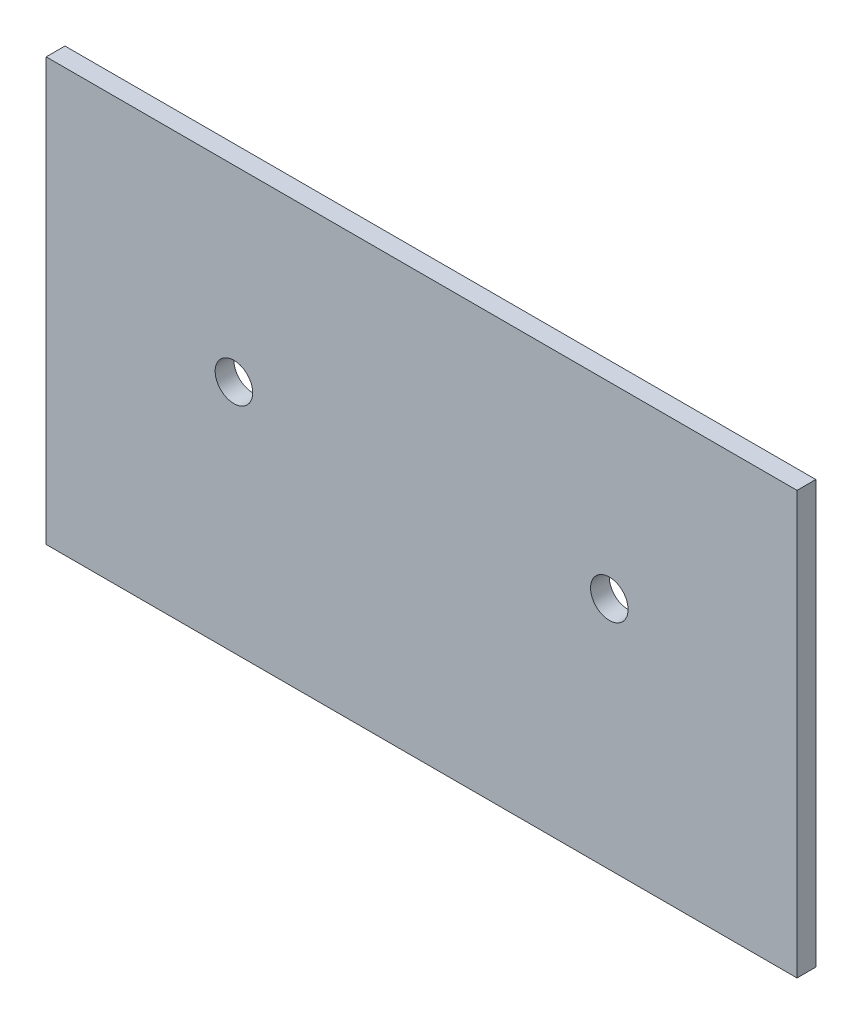
from build123d import *

# Parameters (mm, degrees)
SKETCH1_W           = 80
SKETCH1_H           = 45
BOSS_EXTRUDE1_DEPTH = 2
SKETCH2_R           = 2
CUT_EXTRUDE1_DEPTH  = 46.937457483


with BuildPart() as part:
    # Sketch1 → Boss-Extrude1 (new body)
    with BuildSketch(Plane.XY):
        Rectangle(SKETCH1_W, SKETCH1_H)
    extrude(amount=BOSS_EXTRUDE1_DEPTH)

    # Sketch2 → Cut-Extrude1 (cut, through all)
    with BuildSketch(Plane.XY.offset(2)):
        with Locations((-20, 2.5)):
            Circle(SKETCH2_R)
        with Locations((20, 2.5)):
            Circle(SKETCH2_R)
    extrude(amount=-CUT_EXTRUDE1_DEPTH, mode=Mode.SUBTRACT)


solid = part.part
